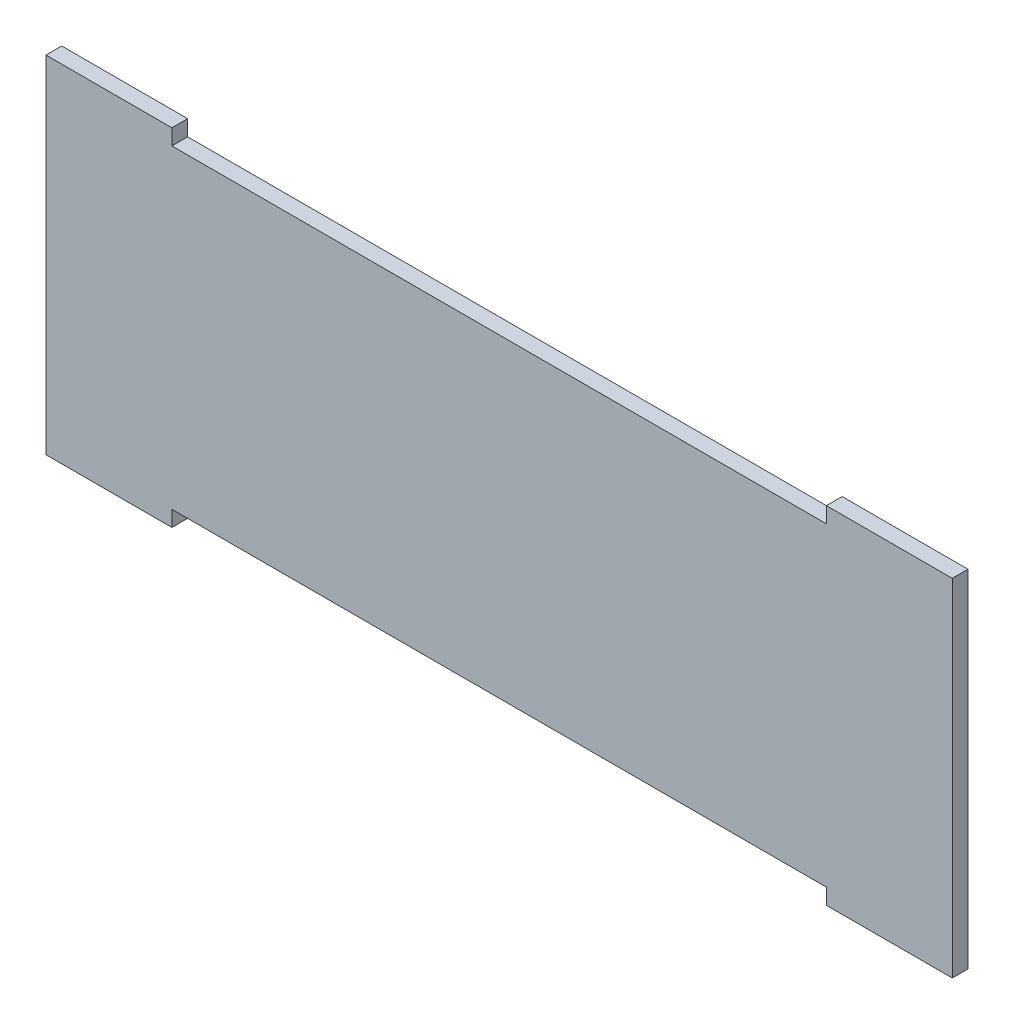
from build123d import *

# Parameters (mm, degrees)
BOSS_EXTRUDE1_DEPTH = 3.175


with BuildPart() as part:
    # Sketch2 → Boss-Extrude1 (new body)
    with BuildSketch(Plane.XY):
        Polygon((-75.455072088, 48.840386), (-50.055072088, 48.840386), (-50.055072088, 45.665386), (82.024927912, 45.665386), (82.024927912, 48.840386), (107.424927912, 48.840386), (107.424927912, -21.009614), (82.024927912, -21.009614), (82.024927912, -17.834614), (-50.055072088, -17.834614), (-50.055072088, -21.009614), (-75.455072088, -21.009614), align=None)
    extrude(amount=BOSS_EXTRUDE1_DEPTH)


solid = part.part
